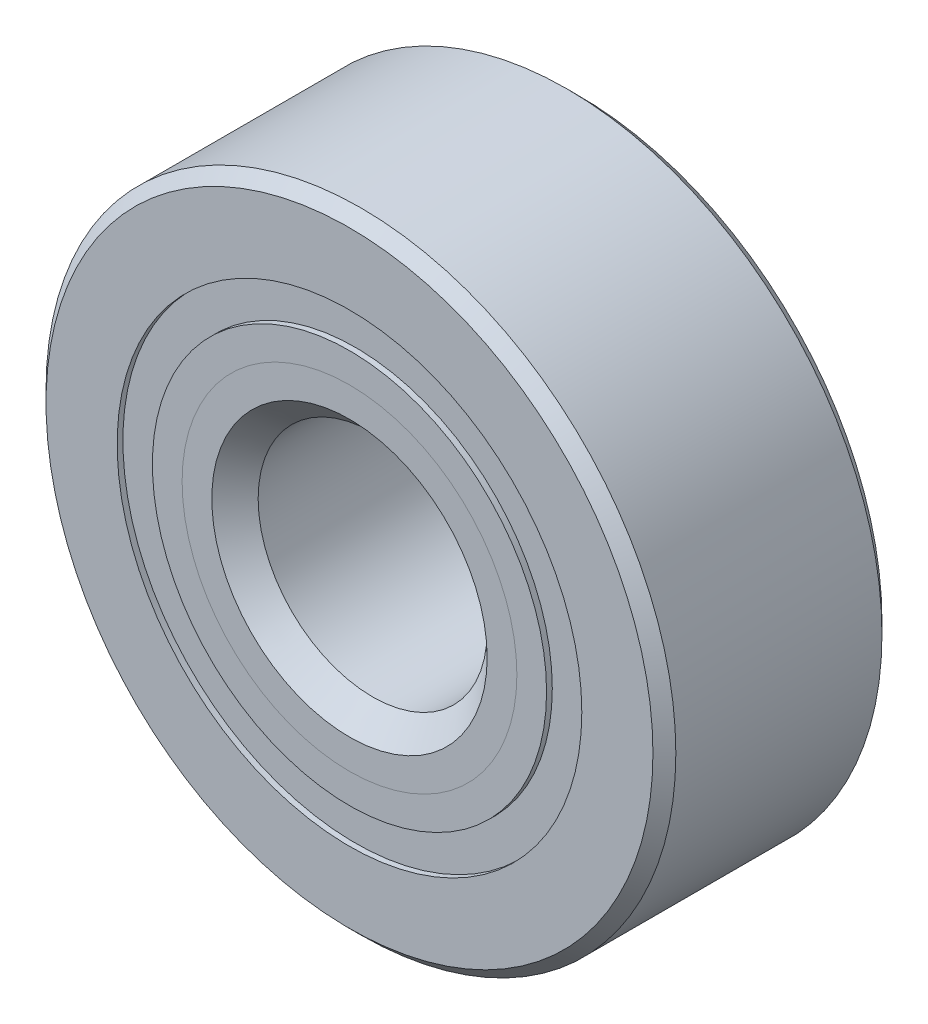
from build123d import *

# Parameters (mm, degrees)
CIRPATTERN1_COUNT = 8
SKETCH5_W         = 1.522988723
SKETCH5_H         = 0.976923076


with BuildPart() as part:
    # Sketch1 → Revolve1 (revolve)
    with BuildSketch(Plane(origin=(0, 0, 0), x_dir=(0, 0, -1), z_dir=(1, 0, 0)), mode=Mode.PRIVATE) as revolve1_sk:
        with BuildLine():
            Line((2.8575, 8.73125), (-2.8575, 8.73125))
            Line((-2.8575, 8.73125), (-3.175, 8.41375))
            Line((-3.175, 8.41375), (-3.175, 6.441586538))
            Line((-3.175, 6.441586538), (-1.411111111, 6.441586538))
            ThreePointArc((-1.411111111, 6.441586538), (0, 7.446386277), (1.411111111, 6.441586538))
            Line((1.411111111, 6.441586538), (3.175, 6.441586538))
            Line((3.175, 6.441586538), (3.175, 8.41375))
            Line((3.175, 8.41375), (2.8575, 8.73125))
        make_face()
    revolve(revolve1_sk.sketch.rotate(Axis((0, 0, 3.175), (0, 0, -1)), 90), axis=Axis((0, 0, 3.175), (0, 0, -1)))


with BuildPart() as body_2:
    # Sketch2 → Revolve2 (revolve)
    with BuildSketch(Plane(origin=(0, 0, 0), x_dir=(0, 0, -1), z_dir=(1, 0, 0)), mode=Mode.PRIVATE) as revolve2_sk:
        with BuildLine():
            Line((-3.175, 5.464663462), (-1.411111111, 5.464663462))
            ThreePointArc((-1.411111111, 5.464663462), (-0.866149104, 4.73673075), (0, 4.459863723))
            Line((0, 4.459863723), (0, 3.817431861))
            Line((0, 3.817431861), (-2.3513842, 3.817431861))
            Line((-2.3513842, 3.817431861), (-3.175, 4.641047661))
            Line((-3.175, 4.641047661), (-3.175, 5.464663462))
        make_face()
    revolve(revolve2_sk.sketch.rotate(Axis((0, 0, 3.175), (0, 0, -1)), 90), axis=Axis((0, 0, 3.175), (0, 0, -1)))


with BuildPart() as body_3:
    # Sketch3 → Revolve3 (revolve)
    with BuildSketch(Plane(origin=(0, 0, 0), x_dir=(0, 0, -1), z_dir=(1, 0, 0)), mode=Mode.PRIVATE) as revolve3_sk:
        with BuildLine():
            Line((-3.175, 4.641047661), (-2.3513842, 3.817431861))
            Line((-2.3513842, 3.817431861), (0, 3.817431861))
            Line((0, 3.817431861), (0, 4.459863723))
            ThreePointArc((0, 4.459863723), (0.866149104, 4.73673075), (1.411111111, 5.464663462))
            Line((1.411111111, 5.464663462), (3.175, 5.464663462))
            Line((3.175, 5.464663462), (3.175, 3.4925))
            Line((3.175, 3.4925), (2.8575, 3.175))
            Line((2.8575, 3.175), (-2.532568139, 3.175))
            Line((-2.532568139, 3.175), (-3.175, 3.817431861))
            Line((-3.175, 3.817431861), (-3.175, 4.641047661))
        make_face()
    revolve(revolve3_sk.sketch.rotate(Axis((0, 0, 3.175), (0, 0, -1)), 90), axis=Axis((0, 0, 3.175), (0, 0, -1)))


with BuildPart() as body_4:
    # Sketch4 → Revolve4 (revolve)
    with BuildSketch(Plane(origin=(0, 0, 0), x_dir=(0, 0, -1), z_dir=(1, 0, 0))):
        with BuildLine():
            Line((-1.493261277, 5.953125), (1.493261277, 5.953125))
            ThreePointArc((1.493261277, 5.953125), (0, 7.446386277), (-1.493261277, 5.953125))
        make_face()
    revolve(axis=Axis((0, 5.953125, 1.493261277), (0, 0, -1)))


with BuildPart() as cirpattern1_1:
    # CirPattern1: pattern copy
    add(body_4.part.rotate(Axis((0, 0, 0), (0, 0, 1)), 1 * 360 / CIRPATTERN1_COUNT))


with BuildPart() as cirpattern1_2:
    # CirPattern1: pattern copy
    add(body_4.part.rotate(Axis((0, 0, 0), (0, 0, 1)), 2 * 360 / CIRPATTERN1_COUNT))


with BuildPart() as cirpattern1_3:
    # CirPattern1: pattern copy
    add(body_4.part.rotate(Axis((0, 0, 0), (0, 0, 1)), 3 * 360 / CIRPATTERN1_COUNT))


with BuildPart() as cirpattern1_4:
    # CirPattern1: pattern copy
    add(body_4.part.rotate(Axis((0, 0, 0), (0, 0, 1)), 4 * 360 / CIRPATTERN1_COUNT))


with BuildPart() as cirpattern1_5:
    # CirPattern1: pattern copy
    add(body_4.part.rotate(Axis((0, 0, 0), (0, 0, 1)), 5 * 360 / CIRPATTERN1_COUNT))


with BuildPart() as cirpattern1_6:
    # CirPattern1: pattern copy
    add(body_4.part.rotate(Axis((0, 0, 0), (0, 0, 1)), 6 * 360 / CIRPATTERN1_COUNT))


with BuildPart() as cirpattern1_7:
    # CirPattern1: pattern copy
    add(body_4.part.rotate(Axis((0, 0, 0), (0, 0, 1)), 7 * 360 / CIRPATTERN1_COUNT))


with BuildPart() as body_12:
    # Sketch5 → Revolve5 (revolve)
    with BuildSketch(Plane(origin=(0, 0, 0), x_dir=(0, 0, -1), z_dir=(1, 0, 0)), mode=Mode.PRIVATE) as revolve5_sk:
        with Locations((-2.254755639, 5.953125)):
            Rectangle(SKETCH5_W, SKETCH5_H)
        with Locations((2.254755639, 5.953125)):
            Rectangle(SKETCH5_W, SKETCH5_H)
    revolve(revolve5_sk.sketch.rotate(Axis((0, 0, 3.175), (0, 0, -1)), 90), axis=Axis((0, 0, 3.175), (0, 0, -1)))


solid = Compound([part.part, body_2.part, body_3.part, body_4.part, cirpattern1_1.part, cirpattern1_2.part, cirpattern1_3.part, cirpattern1_4.part, cirpattern1_5.part, cirpattern1_6.part, cirpattern1_7.part, body_12.part])
